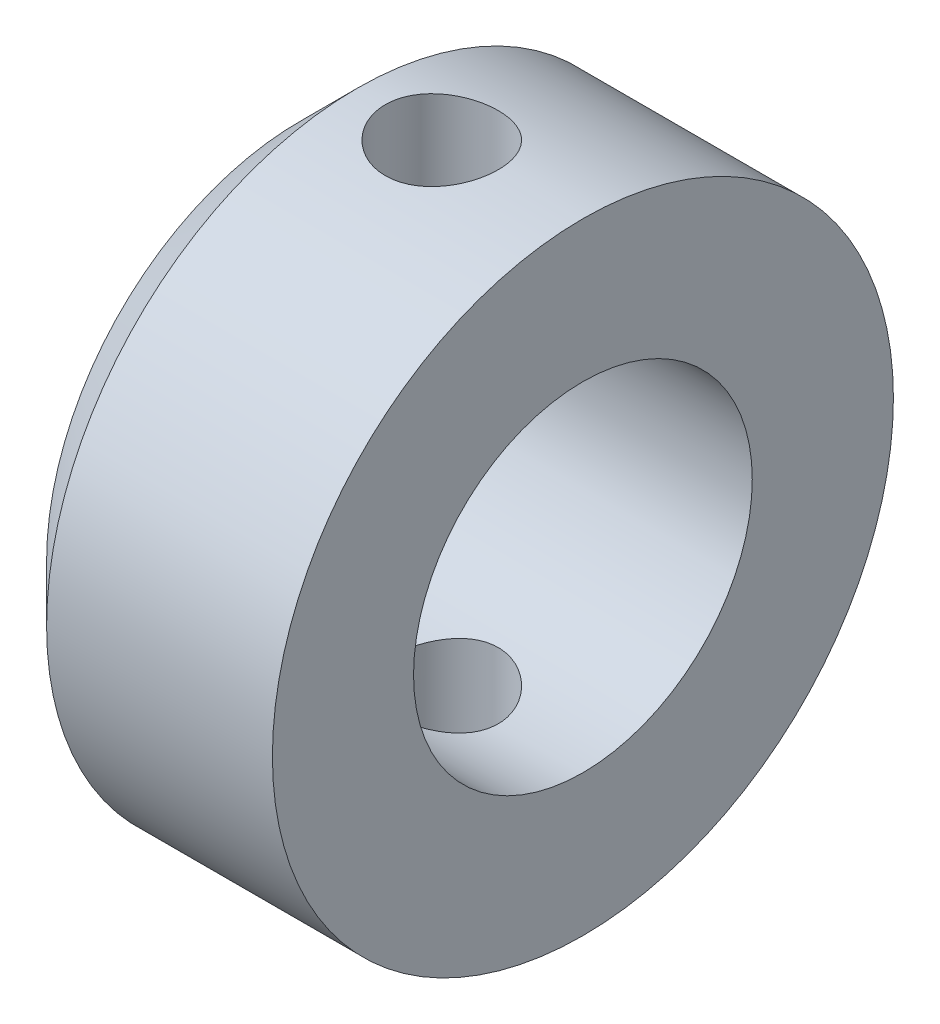
from build123d import *

# Parameters (mm, degrees)
SKETCH_1_W               = 10
SKETCH_1_H               = 11
CHAMFER_1_SIZE           = 2
SKETCH_2_R               = 6
CUT_EXTRUDE_1_DEPTH      = 19.493242009
CUT_EXTRUDE_2_DEPTH      = 19.493242009
CUT_EXTRUDE_2_DEPTH_BACK = 19.493242009
SKETCH_3_R               = 2


with BuildPart() as part:
    # 草图1 → 旋转1 (revolve)
    with BuildSketch(Plane.XY, mode=Mode.PRIVATE) as revolve_1_sk:
        with Locations((-5, 5.5)):
            Rectangle(SKETCH_1_W, SKETCH_1_H)
    revolve(revolve_1_sk.sketch.rotate(Axis((0, 0, 0), (-1, 0, 0)), 90), axis=Axis((0, 0, 0), (-1, 0, 0)))

    # 倒角1
    chamfer_1_edges = [part.edges().sort_by_distance(p)[0] for p in [
        (-10, 0, 11),
    ]]
    chamfer(chamfer_1_edges, length=CHAMFER_1_SIZE)

    # 草图2 → 切除-拉伸1 (cut, through all)
    with BuildSketch(Plane.ZY.offset(10)):
        Circle(SKETCH_2_R)
    extrude(amount=-CUT_EXTRUDE_1_DEPTH, mode=Mode.SUBTRACT)

    # 草图3 → 切除-拉伸2 (cut, two sides: drawn at the far end of the back side and taken through both)
    with BuildSketch(Plane(origin=(0, 0, 0), x_dir=(1, 0, 0), z_dir=(0, 1, 0)).offset(-CUT_EXTRUDE_2_DEPTH_BACK)):
        with Locations(Location((-5, 0, 0), (0, 0, 270))):
            Circle(SKETCH_3_R)
    extrude(amount=CUT_EXTRUDE_2_DEPTH + CUT_EXTRUDE_2_DEPTH_BACK, mode=Mode.SUBTRACT)


solid = part.part
